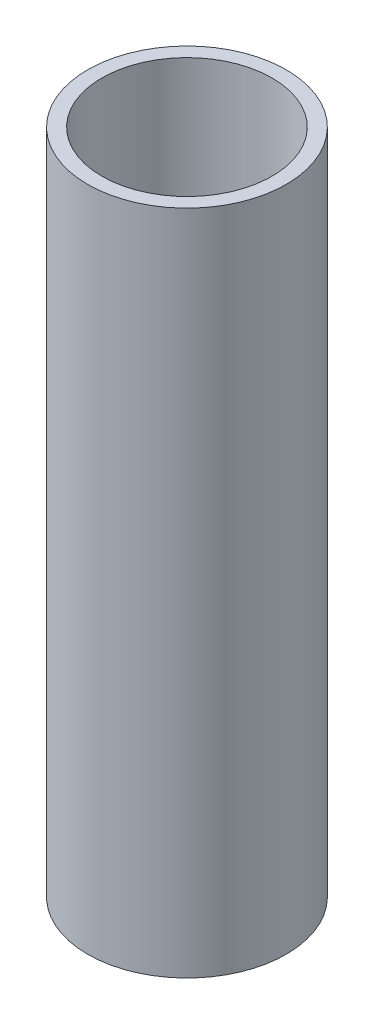
from build123d import *

# Parameters (mm, degrees)
SKETCH1_R           = 44.45
SKETCH1_R_2         = 38.1
BOSS_EXTRUDE1_DEPTH = 298.45


with BuildPart() as part:
    # Sketch1 → Boss-Extrude1 (new body)
    with BuildSketch(Plane(origin=(0, 0, 0), x_dir=(1, 0, 0), z_dir=(0, 1, 0))):
        with Locations(Location((0, 0, 0), (0, 0, 270))):
            Circle(SKETCH1_R)
        with Locations(Location((0, 0, 0), (0, 0, 270))):
            Circle(SKETCH1_R_2, mode=Mode.SUBTRACT)
    extrude(amount=BOSS_EXTRUDE1_DEPTH)


solid = part.part
